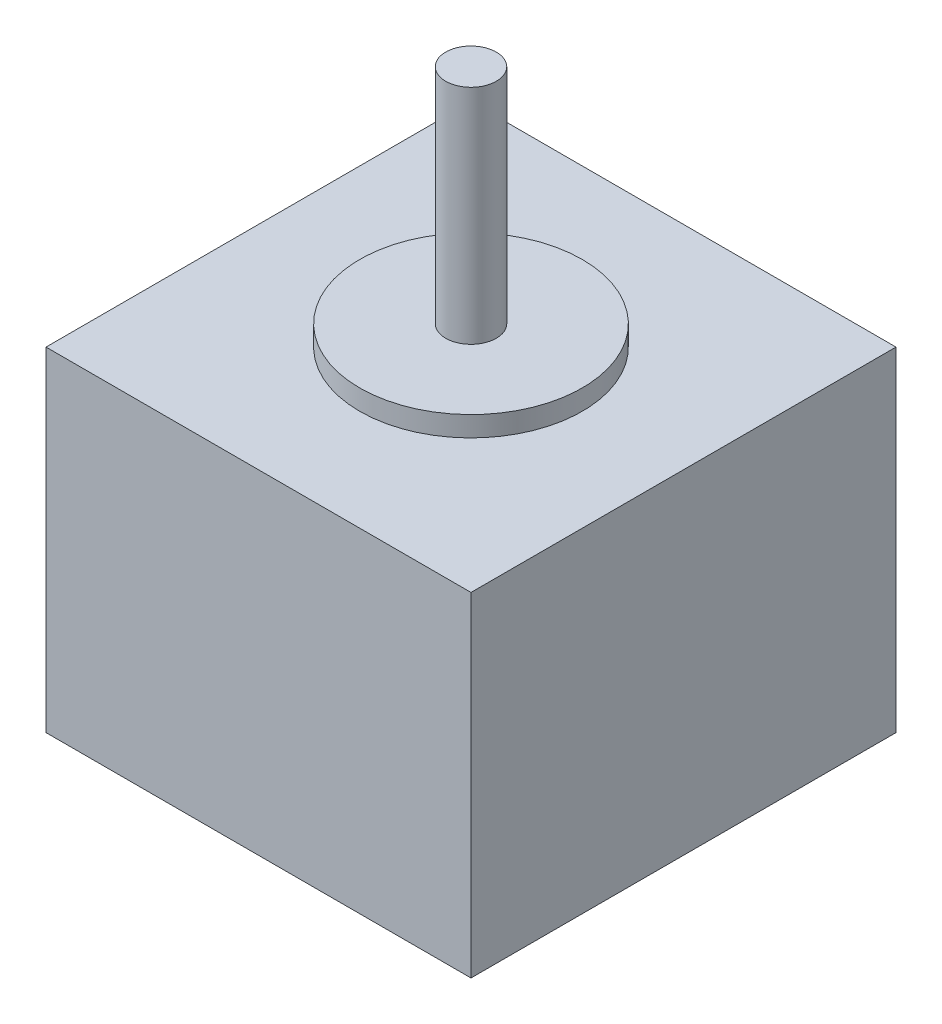
from build123d import *

# Parameters (mm, degrees)
SKETCH1_W           = 42
SKETCH1_H           = 42
BOSS_EXTRUDE1_DEPTH = 33
SKETCH2_R           = 11
BOSS_EXTRUDE2_DEPTH = 2
SKETCH3_R           = 2.5
BOSS_EXTRUDE3_DEPTH = 22


with BuildPart() as part:
    # Sketch1 → Boss-Extrude1 (new body)
    with BuildSketch(Plane(origin=(0, 0, 0), x_dir=(1, 0, 0), z_dir=(0, 1, 0))):
        Rectangle(SKETCH1_W, SKETCH1_H)
    extrude(amount=BOSS_EXTRUDE1_DEPTH)

    # Sketch2 → Boss-Extrude2 (add)
    with BuildSketch(Plane(origin=(0, 33, 0), x_dir=(1, 0, 0), z_dir=(0, 1, 0))):
        with Locations(Location((0, 0, 0), (0, 0, 270))):
            Circle(SKETCH2_R)
    extrude(amount=BOSS_EXTRUDE2_DEPTH)

    # Sketch3 → Boss-Extrude3 (add)
    with BuildSketch(Plane(origin=(0, 35, 0), x_dir=(1, 0, 0), z_dir=(0, 1, 0))):
        with Locations(Location((0, 0, 0), (0, 0, 270))):
            Circle(SKETCH3_R)
    extrude(amount=BOSS_EXTRUDE3_DEPTH)


solid = part.part
